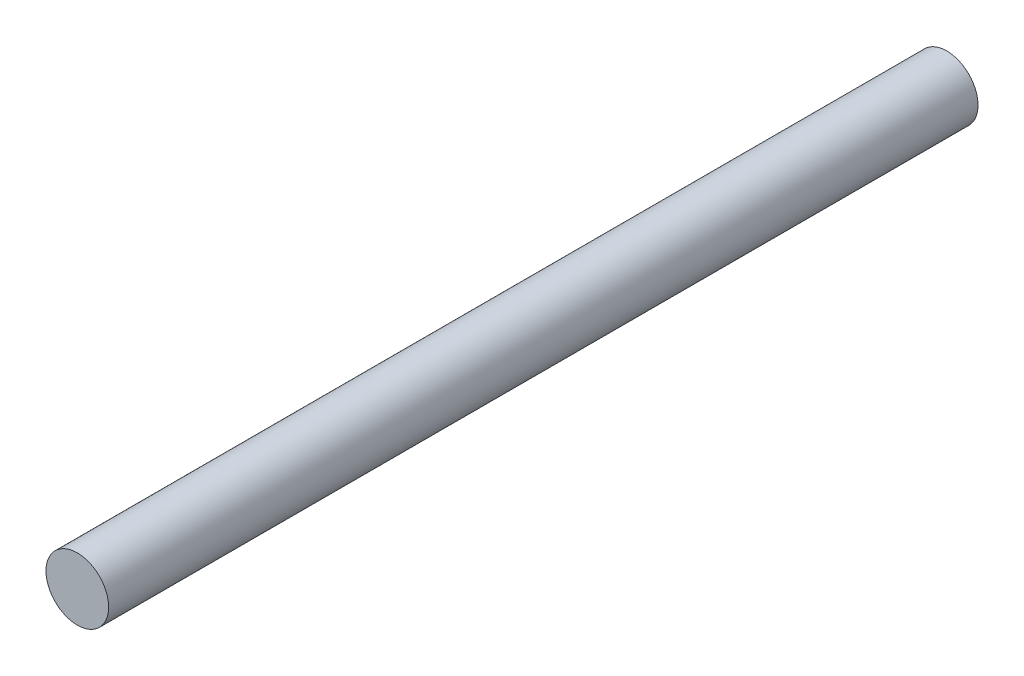
from build123d import *

# Parameters (mm, degrees)
SKETCH2_R           = 1.5875
BOSS_EXTRUDE1_DEPTH = 44.07


with BuildPart() as part:
    # Sketch2 → Boss-Extrude1 (new body)
    with BuildSketch(Plane.XY):
        with Locations(Location((0, 0, 0), (0, 0, 180))):
            Circle(SKETCH2_R)
    extrude(amount=BOSS_EXTRUDE1_DEPTH)


solid = part.part
